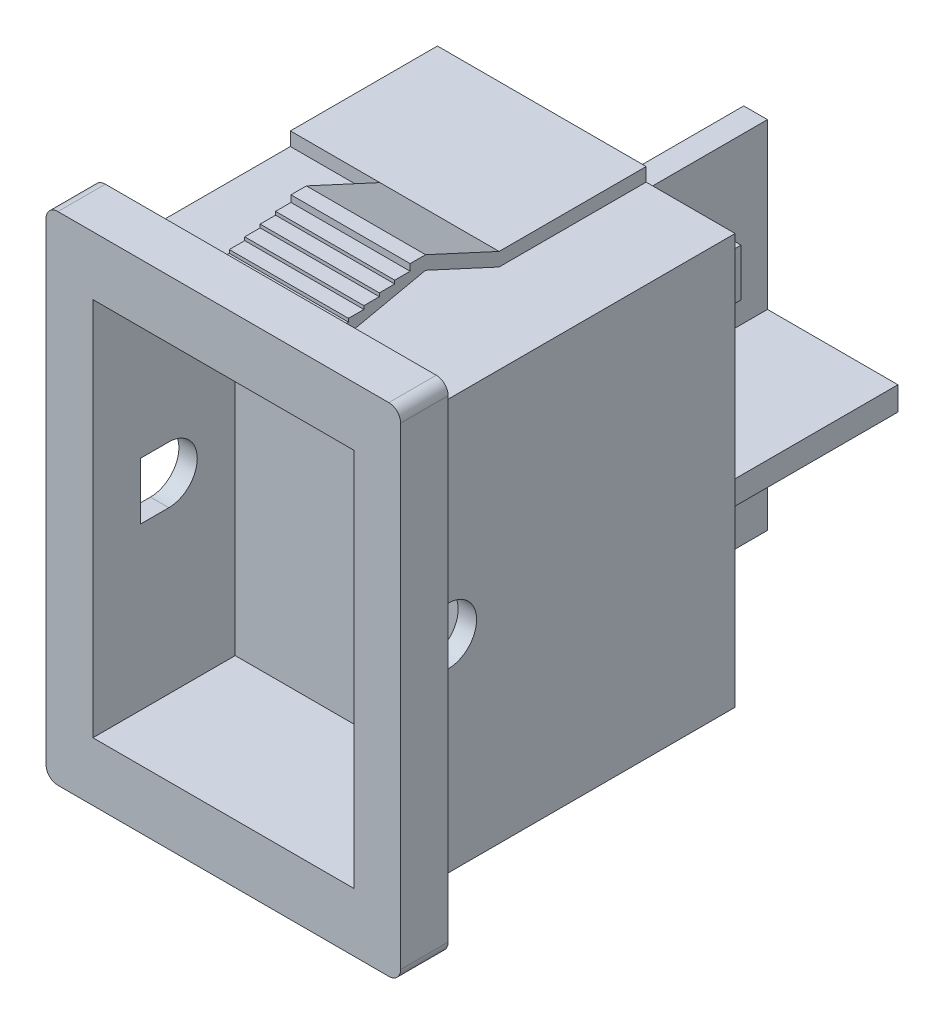
from build123d import *

# Parameters (mm, degrees)
SKETCH1_W                = 14.95
SKETCH1_H                = 20.95
SKETCH1_W_2              = 11
SKETCH1_H_2              = 16
BOSS_EXTRUDE1_DEPTH      = 2
SKETCH2_W                = 12.55
SKETCH2_H                = 17.3
BOSS_EXTRUDE2_DEPTH      = 13.3
SKETCH3_W                = 6.2
SKETCH3_H                = 18.44
BOSS_EXTRUDE3_DEPTH      = 8.8
BOSS_EXTRUDE4_DEPTH      = 2.525
BOSS_EXTRUDE4_DEPTH_BACK = 2.5
BOSS_EXTRUDE5_DEPTH      = 7.14
SKETCH6_W                = 2.5
SKETCH6_H                = 2
BOSS_EXTRUDE6_DEPTH      = 1
CUT_EXTRUDE1_REACH       = 28.838
SKETCH8_W                = 11
SKETCH8_H                = 16
CUT_EXTRUDE2_DEPTH       = 4
FILLET1_R                = 0.5


with BuildPart() as part:
    # Sketch1 → Boss-Extrude1 (new body)
    with BuildSketch(Plane.XY):
        Rectangle(SKETCH1_W, SKETCH1_H)
        Rectangle(SKETCH1_W_2, SKETCH1_H_2, mode=Mode.SUBTRACT)
    extrude(amount=BOSS_EXTRUDE1_DEPTH)

    # Sketch2 → Boss-Extrude2 (add)
    with BuildSketch(Plane(origin=(0, 0, 0), x_dir=(-1, 0, 0), z_dir=(0, 0, -1))):
        Rectangle(SKETCH2_W, SKETCH2_H)
    extrude(amount=BOSS_EXTRUDE2_DEPTH)

    # Sketch3 → Boss-Extrude3 (add)
    with BuildSketch(Plane.ZY.offset(6.275)):
        with Locations((-10.2, 0)):
            Rectangle(SKETCH3_W, SKETCH3_H)
    extrude(amount=-BOSS_EXTRUDE3_DEPTH)

    # Sketch4 → Boss-Extrude4 (add, two sides: drawn at the far end of the back side and taken through both)
    with BuildSketch(Plane(origin=(0, 0, 0), x_dir=(0, 0, -1), z_dir=(1, 0, 0)).offset(-BOSS_EXTRUDE4_DEPTH_BACK)):
        Polygon((7.1, -9.22), (4, -10.65), (3.35, -10.65), (3.35, -10.3705), (2.7, -10.3705), (2.7, -10.23075), (2.05, -10.23075), (2.05, -10.091), (1.4, -10.091), (1.4, -9.95125), (0.75, -9.95125), (0.75, -9.8115), (0, -9.8115), (0, -9.22), (4, -10.08), (7.1, -8.65), align=None)
        Polygon((7.1, 9.22), (7.1, 8.65), (4, 10.08), (0, 9.22), (0, 9.8115), (0.75, 9.8115), (0.75, 9.95125), (1.4, 9.95125), (1.4, 10.091), (2.05, 10.091), (2.05, 10.23075), (2.7, 10.23075), (2.7, 10.3705), (3.35, 10.3705), (3.35, 10.65), (4, 10.65), align=None)
    extrude(amount=BOSS_EXTRUDE4_DEPTH + BOSS_EXTRUDE4_DEPTH_BACK)

    # Sketch5 → Boss-Extrude5 (add)
    with BuildSketch(Plane(origin=(0, 0, -13.3), x_dir=(-1, 0, 0), z_dir=(0, 0, -1))):
        Polygon((0.5, 6.35), (-0.5, 6.35), (-0.5, -0.58), (-6, -0.58), (-6, -1.58), (-0.5, -1.58), (-0.5, -8.65), (0.5, -8.65), (0.5, -1.58), (6, -1.58), (6, -0.58), (0.5, -0.58), align=None)
    extrude(amount=BOSS_EXTRUDE5_DEPTH)

    # Sketch6 → Boss-Extrude6 (add)
    with BuildSketch(Plane(origin=(0, 0, -13.3), x_dir=(-1, 0, 0), z_dir=(0, 0, -1))):
        with Locations((2.232930788, -2.58)):
            Rectangle(SKETCH6_W, SKETCH6_H)
        with Locations((2.232930788, -7.58)):
            Rectangle(SKETCH6_W, SKETCH6_H)
        with Locations((-2.232930788, -7.58)):
            Rectangle(SKETCH6_W, SKETCH6_H)
        with Locations((-2.232930788, -2.58)):
            Rectangle(SKETCH6_W, SKETCH6_H)
        with Locations((4.275, 6.35)):
            Rectangle(SKETCH6_W, SKETCH6_H)
        with Locations((-4.275, 6.35)):
            Rectangle(SKETCH6_W, SKETCH6_H)
    extrude(amount=BOSS_EXTRUDE6_DEPTH)

    # Cut-Extrude1: up to this face of the body (flat: up to its plane)
    cut_extrude1_end = Plane(part.part.faces().sort_by_distance((-6.275, 0, -6.755800353))[0])
    # Sketch7 → Cut-Extrude1 (cut, up to the picked face)
    with BuildSketch(Plane(origin=(6.275, 0, 0), x_dir=(0, 0, -1), z_dir=(1, 0, 0)), mode=Mode.PRIVATE) as cut_extrude1_sk1:
        with BuildLine():
            Line((1.2, 1.2), (0, 1.2))
            Line((0, 1.2), (0, -1.2))
            Line((0, -1.2), (1.2, -1.2))
            ThreePointArc((1.2, -1.2), (2.4, 0), (1.2, 1.2))
        make_face()
    cut_extrude1_tool1 = split(extrude(cut_extrude1_sk1.sketch, amount=-CUT_EXTRUDE1_REACH, mode=Mode.PRIVATE), bisect_by=cut_extrude1_end, keep=Keep.BOTH, mode=Mode.PRIVATE)
    add(cut_extrude1_tool1.solids().sort_by(Axis((6.275, 0, -1.08798), (-1, 0, 0)))[0], mode=Mode.SUBTRACT)

    # Sketch8 → Cut-Extrude2 (cut)
    with BuildSketch(Plane.XY):
        Rectangle(SKETCH8_W, SKETCH8_H)
    extrude(amount=-CUT_EXTRUDE2_DEPTH, mode=Mode.SUBTRACT)

    # Fillet1
    fillet1_edges = [part.edges().sort_by_distance(p)[0] for p in [
        (-7.475, 10.475, 1),
        (7.475, 10.475, 1),
        (7.475, -10.475, 1),
        (-7.475, -10.475, 1),
    ]]
    fillet(fillet1_edges, radius=FILLET1_R)


solid = part.part
